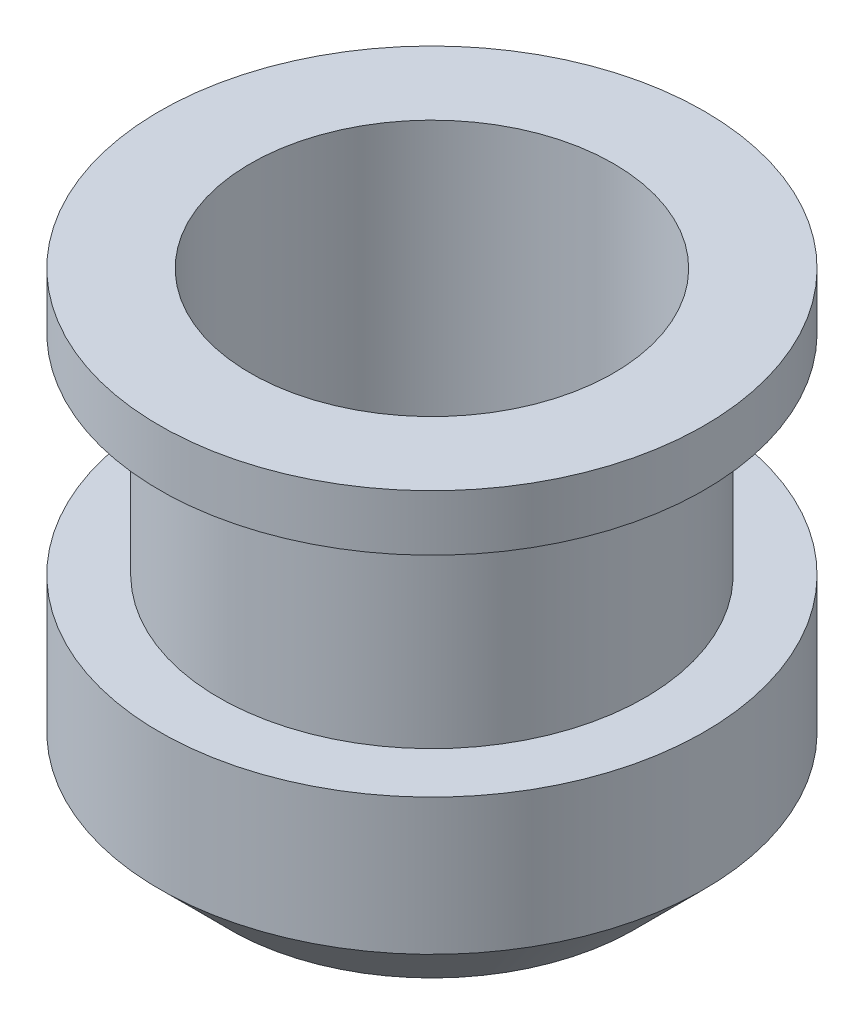
from build123d import *


with BuildPart() as part:
    # Sketch1 → Revolve1 (revolve)
    with BuildSketch(Plane.XY, mode=Mode.PRIVATE) as revolve1_sk:
        Polygon((-2.6, 0), (-3.9, 0), (-3.9, -0.8), (-3.05, -0.8), (-3.05, -3.8), (-3.9, -3.8), (-3.9, -5.75), (-2.9, -6.75), (-2.6, -6.75), align=None)
    revolve(revolve1_sk.sketch.rotate(Axis((0, 0, 0), (0, 1, 0)), 270), axis=Axis((0, 0, 0), (0, 1, 0)))


solid = part.part
